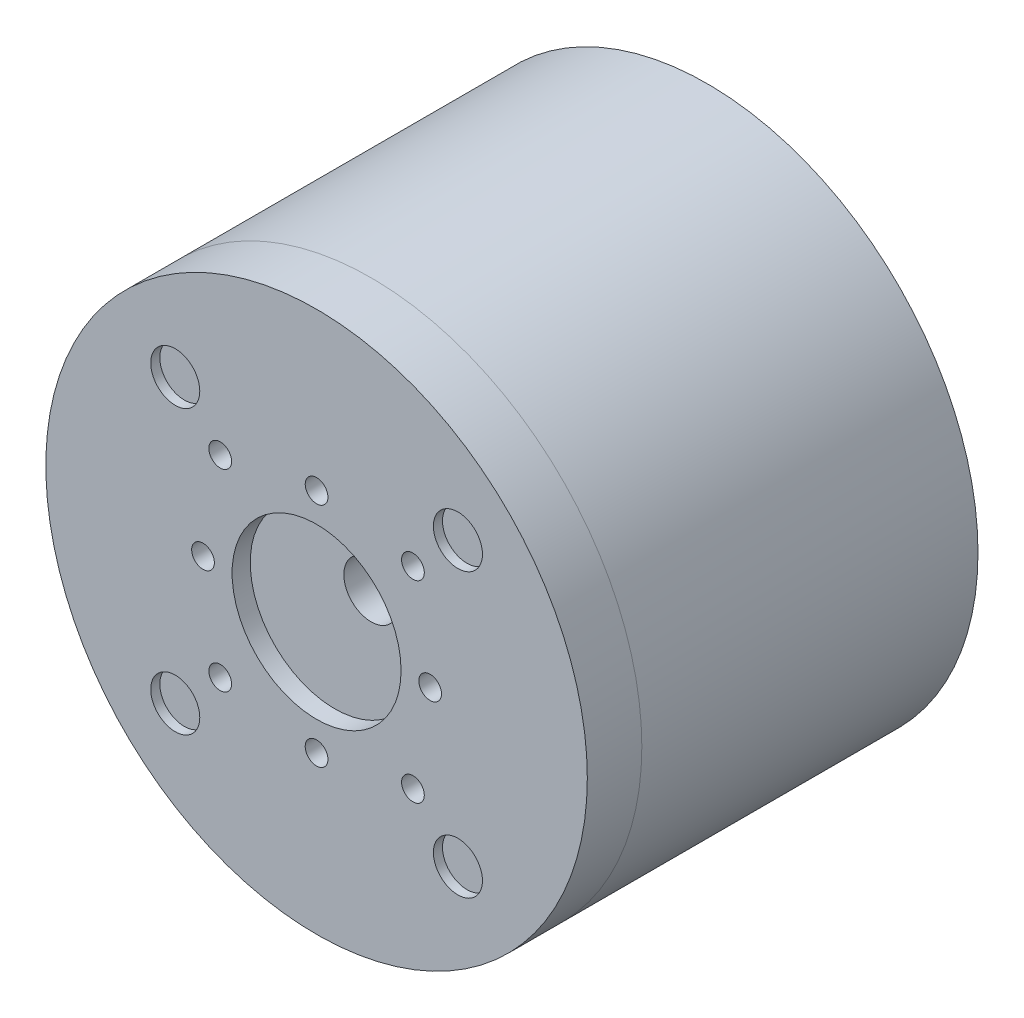
from build123d import *

# Parameters (mm, degrees)
SKETCH_1_R                                       = 29.8
SKETCH_1_R_2                                     = 3
F_01_MAINHOUSING_OD59_6_L37_DEPTH                = 37
SKETCH_2_R                                       = 6.35
F_02_FRONTBEARINGSEAT_D12_7_DEPTH1_ASSUMED_DEPTH = 1
ROTOR_FRONT_PCD25_CLOCKED45_RELATIVE_TO_R        = 1.25
F_03_FRONT_4XM3_PCD25_DEPTH5_ASSUMED_DEPTH       = 5
F_04_ENCODERCOVER_RIM_L6_ASSUMED_START           = 37
SKETCH_4_R                                       = 29.8
SKETCH_4_R_2                                     = 27.8
F_04_ENCODERCOVER_RIM_L6_ASSUMED_DEPTH           = 6
F_05_ENCODERCOVER_FACE_T2_ASSUMED_START          = 41
SKETCH_5_R                                       = 27.8
SKETCH_5_R_2                                     = 9.3
F_05_ENCODERCOVER_FACE_T2_ASSUMED_DEPTH          = 2
F_06_COVER_4XM3_PCD25_ASSUMED_START              = 41
SKETCH_6_R                                       = 1.25
F_06_COVER_4XM3_PCD25_ASSUMED_DEPTH              = 2
F_07_COVER_4XM3_PCD30_ASSUMED_START              = 41
SKETCH_7_R                                       = 1.25
F_07_COVER_4XM3_PCD30_ASSUMED_DEPTH              = 2
F_08_COVER_4XFASTENERSEATS_PCD44_ASSUMED_START   = 42
SKETCH_8_R                                       = 2.7
F_08_COVER_4XFASTENERSEATS_PCD44_ASSUMED_DEPTH   = 1


with BuildPart() as part:
    # 草图1 → 01_MainHousing_OD59.6_L37 (new body)
    with BuildSketch(Plane.XY):
        Circle(SKETCH_1_R)
        Circle(SKETCH_1_R_2, mode=Mode.SUBTRACT)
    extrude(amount=F_01_MAINHOUSING_OD59_6_L37_DEPTH)

    # 草图2 → 02_FrontBearingSeat_D12.7_Depth1_ASSUMED (cut)
    with BuildSketch(Plane.XY):
        Circle(SKETCH_2_R)
    extrude(amount=F_02_FRONTBEARINGSEAT_D12_7_DEPTH1_ASSUMED_DEPTH, mode=Mode.SUBTRACT)

    # Rotor_front_PCD25_clocked45_relative_to_stator → 03_Front_4xM3_PCD25_Depth5_ASSUMED (cut)
    with BuildSketch(Plane.XY):
        with Locations((8.838834765, 8.838834765)):
            Circle(ROTOR_FRONT_PCD25_CLOCKED45_RELATIVE_TO_R)
        with Locations((-8.838834765, 8.838834765)):
            Circle(ROTOR_FRONT_PCD25_CLOCKED45_RELATIVE_TO_R)
        with Locations((-8.838834765, -8.838834765)):
            Circle(ROTOR_FRONT_PCD25_CLOCKED45_RELATIVE_TO_R)
        with Locations((8.838834765, -8.838834765)):
            Circle(ROTOR_FRONT_PCD25_CLOCKED45_RELATIVE_TO_R)
    extrude(amount=F_03_FRONT_4XM3_PCD25_DEPTH5_ASSUMED_DEPTH, mode=Mode.SUBTRACT)


with BuildPart() as body_2:
    # 草图4 → 04_EncoderCover_Rim_L6_ASSUMED (new body)
    with BuildSketch(Plane.XY.offset(F_04_ENCODERCOVER_RIM_L6_ASSUMED_START)):
        Circle(SKETCH_4_R)
        Circle(SKETCH_4_R_2, mode=Mode.SUBTRACT)
    extrude(amount=F_04_ENCODERCOVER_RIM_L6_ASSUMED_DEPTH)

    # 草图5 → 05_EncoderCover_Face_T2_ASSUMED (add)
    with BuildSketch(Plane.XY.offset(F_05_ENCODERCOVER_FACE_T2_ASSUMED_START)):
        Circle(SKETCH_5_R)
        Circle(SKETCH_5_R_2, mode=Mode.SUBTRACT)
    extrude(amount=F_05_ENCODERCOVER_FACE_T2_ASSUMED_DEPTH)

    # 草图6 → 06_Cover_4xM3_PCD25_ASSUMED (cut)
    with BuildSketch(Plane.XY.offset(F_06_COVER_4XM3_PCD25_ASSUMED_START)):
        with Locations((12.5, 0)):
            Circle(SKETCH_6_R)
        with Locations((0, 12.5)):
            Circle(SKETCH_6_R)
        with Locations((-12.5, 0)):
            Circle(SKETCH_6_R)
        with Locations((0, -12.5)):
            Circle(SKETCH_6_R)
    extrude(amount=F_06_COVER_4XM3_PCD25_ASSUMED_DEPTH, mode=Mode.SUBTRACT)

    # 草图7 → 07_Cover_4xM3_PCD30_ASSUMED (cut)
    with BuildSketch(Plane.XY.offset(F_07_COVER_4XM3_PCD30_ASSUMED_START)):
        with Locations((10.606601718, 10.606601718)):
            Circle(SKETCH_7_R)
        with Locations((-10.606601718, 10.606601718)):
            Circle(SKETCH_7_R)
        with Locations((-10.606601718, -10.606601718)):
            Circle(SKETCH_7_R)
        with Locations((10.606601718, -10.606601718)):
            Circle(SKETCH_7_R)
    extrude(amount=F_07_COVER_4XM3_PCD30_ASSUMED_DEPTH, mode=Mode.SUBTRACT)

    # 草图8 → 08_Cover_4xFastenerSeats_PCD44_ASSUMED (cut)
    with BuildSketch(Plane.XY.offset(F_08_COVER_4XFASTENERSEATS_PCD44_ASSUMED_START)):
        with Locations((15.556349186, 15.556349186)):
            Circle(SKETCH_8_R)
        with Locations((-15.556349186, 15.556349186)):
            Circle(SKETCH_8_R)
        with Locations((-15.556349186, -15.556349186)):
            Circle(SKETCH_8_R)
        with Locations((15.556349186, -15.556349186)):
            Circle(SKETCH_8_R)
    extrude(amount=F_08_COVER_4XFASTENERSEATS_PCD44_ASSUMED_DEPTH, mode=Mode.SUBTRACT)


solid = Compound([part.part, body_2.part])
